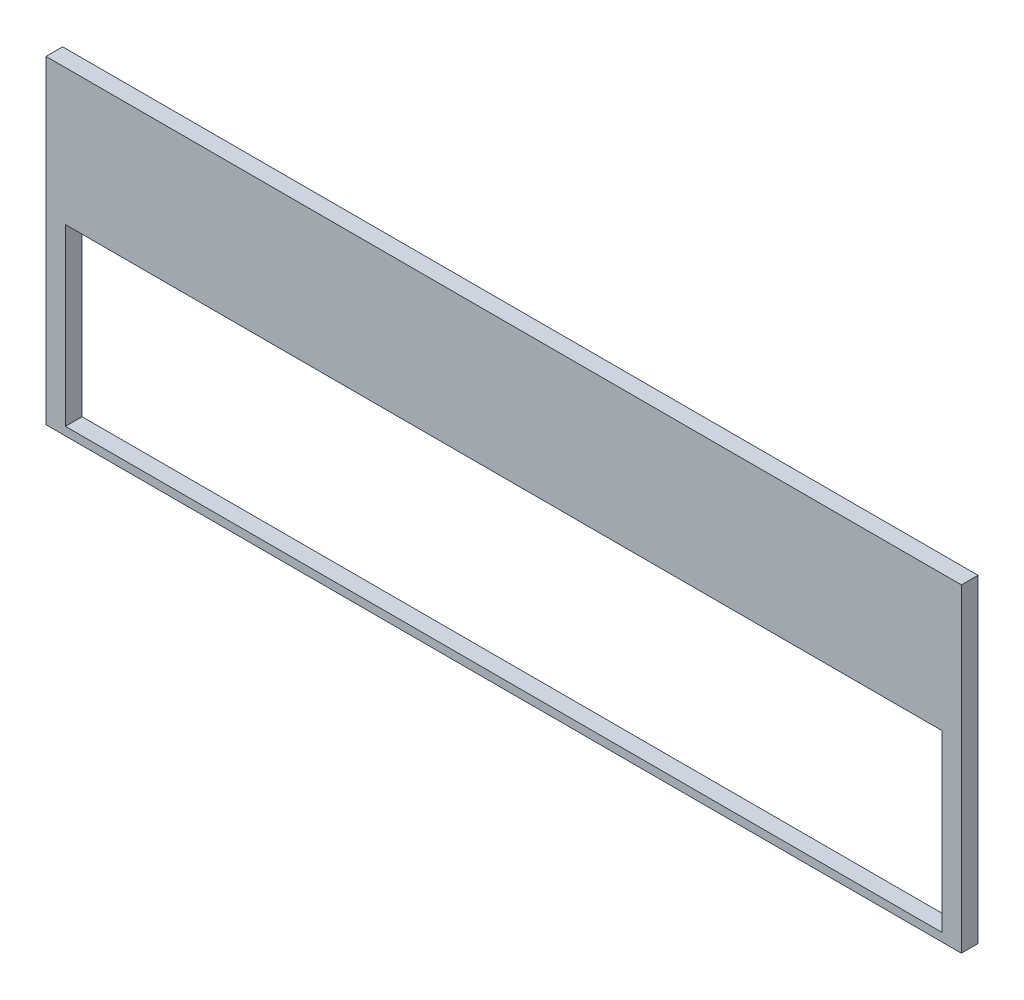
from build123d import *

# Parameters (mm, degrees)
ESQUISSE1_W             = 330
ESQUISSE1_H             = 115
BOSS_EXTRU_1_DEPTH      = 6
ESQUISSE2_W             = 316
ESQUISSE2_H             = 63
ENL_V_MAT_EXTRU_1_DEPTH = 175.834922141


with BuildPart() as part:
    # Esquisse1 → Boss.-Extru.1 (new body)
    with BuildSketch(Plane.XY):
        Rectangle(ESQUISSE1_W, ESQUISSE1_H)
    extrude(amount=BOSS_EXTRU_1_DEPTH)

    # Esquisse2 → Enlèv. mat.-Extru.1 (cut, through all)
    with BuildSketch(Plane(origin=(0, 0, 0), x_dir=(-1, 0, 0), z_dir=(0, 0, -1))):
        with Locations((0, -23)):
            Rectangle(ESQUISSE2_W, ESQUISSE2_H)
    extrude(amount=-ENL_V_MAT_EXTRU_1_DEPTH, mode=Mode.SUBTRACT)


solid = part.part
